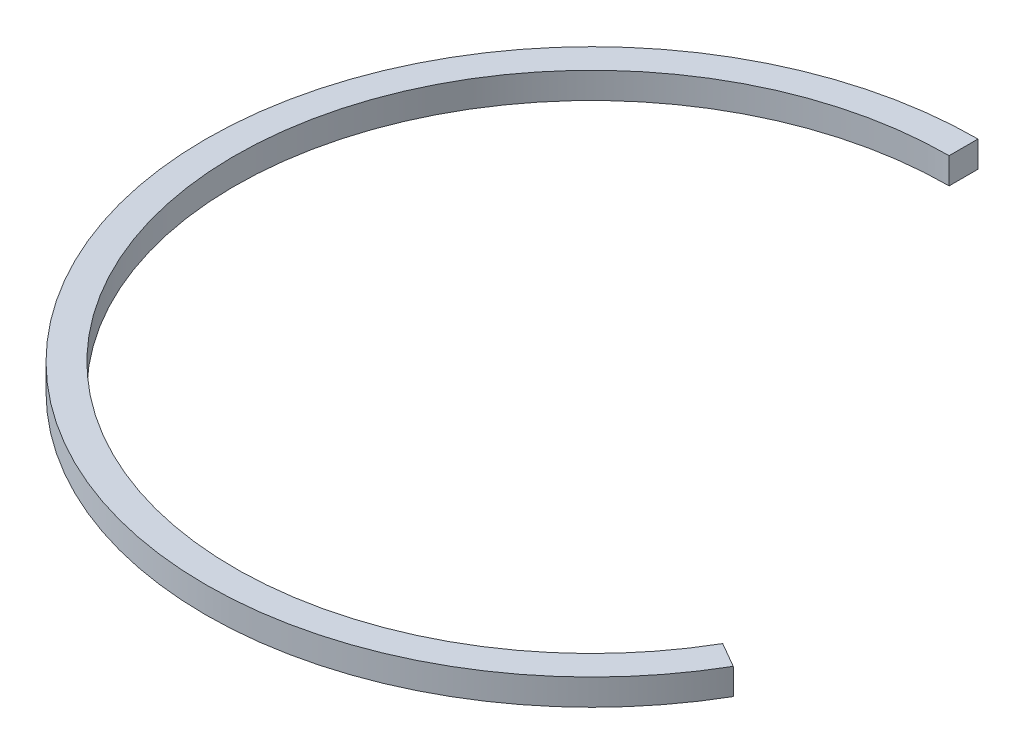
from build123d import *

# Parameters (mm, degrees)
BOSS_EXTRUDE1_DEPTH = 3.175


with BuildPart() as part:
    # Sketch1 → Boss-Extrude1 (new body)
    with BuildSketch(Plane(origin=(0, 0, 0), x_dir=(1, 0, 0), z_dir=(0, 1, 0))):
        with BuildLine():
            Line((0, 43.3), (0, 46.8))
            ThreePointArc((0, 46.8), (-40.529988897, -23.4), (40.529988897, -23.4))
            Line((40.529988897, -23.4), (37.498899984, -21.65))
            ThreePointArc((37.498899984, -21.65), (-37.498899984, -21.65), (0, 43.3))
        make_face()
    extrude(amount=BOSS_EXTRUDE1_DEPTH)


solid = part.part
